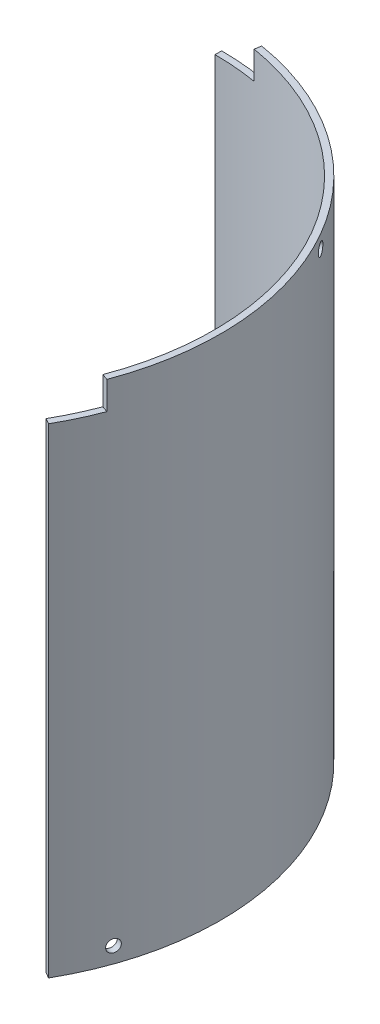
from build123d import *
from build123d.topology import SkipClean

# Parameters (mm, degrees)
BOSS_EXTRUDE1_DEPTH = 93
SKETCH8_R           = 1.125
CUT_EXTRUDE1_DEPTH  = 124.766046621
CIRPATTERN1_COUNT   = 2
CIRPATTERN1_ANGLE   = 99
SKETCH9_R           = 1.125
CUT_EXTRUDE2_DEPTH  = 4
CUT_EXTRUDE3_START  = -5.2
CUT_EXTRUDE3_DEPTH  = 5.2
CUT_EXTRUDE4_START  = -0.1
CUT_EXTRUDE4_DEPTH  = 0.1
CUT_EXTRUDE5_DEPTH  = 0.1
CUT_EXTRUDE7_DEPTH  = 117.6697906


with BuildPart() as part:
    # Sketch1 → Boss-Extrude1 (new body)
    with BuildSketch(Plane(origin=(0, 0, 0), x_dir=(1, 0, 0), z_dir=(0, 1, 0))):
        with BuildLine():
            Line((43.301270189, 25), (42.262039705, 24.4))
            ThreePointArc((42.262039705, 24.4), (47.137180323, 12.630369401), (48.8, 0))
            ThreePointArc((48.8, 0), (47.137180323, -12.630369401), (42.262039705, -24.4))
            Line((42.262039705, -24.4), (43.301270189, -25))
            ThreePointArc((43.301270189, -25), (48.296291314, -12.940952255), (50, 0))
            ThreePointArc((50, 0), (48.296291314, 12.940952255), (43.301270189, 25))
        make_face()
        with BuildLine():
            ThreePointArc((0, 48.8), (24.4, 42.262039705), (42.262039705, 24.4))
            Line((42.262039705, 24.4), (43.301270189, 25))
            ThreePointArc((43.301270189, 25), (25, 43.301270189), (0, 50))
            Line((0, 50), (0, 48.8))
        make_face()
    extrude(amount=BOSS_EXTRUDE1_DEPTH)

    # Sketch8 → Cut-Extrude1 (cut, through all)
    with BuildSketch(Plane(origin=(47.132074555, 0, 16.690342962), x_dir=(0.33380685923377484, 0, -0.9426414910921771), z_dir=(0.9426414910921771, 0, 0.33380685923377484))):
        with Locations((0, 3)):
            Circle(SKETCH8_R)
    cut_extrude1 = extrude(amount=-CUT_EXTRUDE1_DEPTH, mode=Mode.SUBTRACT)

    # CirPattern1: Cut-Extrude1 ×2 about axis
    cirpattern1_axis = Axis((0, 93, 0), (0, 1, 0))
    for i in range(1, CIRPATTERN1_COUNT):
        add(cut_extrude1.rotate(cirpattern1_axis, i * CIRPATTERN1_ANGLE / (CIRPATTERN1_COUNT - 1)), mode=Mode.SUBTRACT)

    # Sketch9 → Cut-Extrude2 (cut)
    with SkipClean():  # the faces are left unmerged after this step: merging them gives an invalid solid
        with BuildSketch(Plane(origin=(43.301270189, 0, -25), x_dir=(-0.4999999999999981, 0, -0.8660254037844397), z_dir=(0.8660254037844398, 0, -0.4999999999999982))):
            with Locations((0, 90.5)):
                Circle(SKETCH9_R)
        extrude(amount=-CUT_EXTRUDE2_DEPTH, mode=Mode.SUBTRACT)

    # Sketch10 → Cut-Extrude3 (cut)
    with SkipClean():  # the faces are left unmerged after this step: merging them gives an invalid solid
        with BuildSketch(Plane(origin=(0, 93, 0), x_dir=(1, 0, 0), z_dir=(0, 1, 0)).offset(CUT_EXTRUDE3_START)):
            with BuildLine():
                ThreePointArc((45.681823724, -17.164235528), (44.120515076, -20.852341582), (42.262039705, -24.4))
                Line((42.262039705, -24.4), (43.301270189, -25))
                ThreePointArc((43.301270189, -25), (45.205445775, -21.365104079), (46.805147258, -17.586306893))
                Line((46.805147258, -17.586306893), (45.681823724, -17.164235528))
            make_face()
            with BuildLine():
                Line((0, 50), (0, 48.8))
                ThreePointArc((0, 48.8), (4.015214241, 48.634535616), (8.0032, 48.139264533))
                Line((8.0032, 48.139264533), (8.2, 49.323016939))
                ThreePointArc((8.2, 49.323016939), (4.113949017, 49.83046682), (0, 50))
            make_face()
        extrude(amount=CUT_EXTRUDE3_DEPTH, mode=Mode.SUBTRACT)

    # Sketch11 → Cut-Extrude4 (cut)
    with SkipClean():  # the faces are left unmerged after this step: merging them gives an invalid solid
        with BuildSketch(Plane(origin=(0, 93, 0), x_dir=(1, 0, 0), z_dir=(0, 1, 0)).offset(CUT_EXTRUDE4_START)):
            with BuildLine():
                Line((8.2, 49.323016939), (8.0032, 48.139264533))
                ThreePointArc((8.0032, 48.139264533), (42.26886825, 24.388168789), (45.681823724, -17.164235528))
                Line((45.681823724, -17.164235528), (46.805147258, -17.586306893))
                ThreePointArc((46.805147258, -17.586306893), (43.308266649, 24.987877858), (8.2, 49.323016939))
            make_face()
        extrude(amount=CUT_EXTRUDE4_DEPTH, mode=Mode.SUBTRACT)

    # Sketch1<3> → Cut-Extrude5 (cut)
    with SkipClean():  # the faces are left unmerged after this step: merging them gives an invalid solid
        with BuildSketch(Plane(origin=(0, 0, 0), x_dir=(1, 0, 0), z_dir=(0, 1, 0))):
            with BuildLine():
                Line((43.301270189, 25), (42.262039705, 24.4))
                ThreePointArc((42.262039705, 24.4), (47.137180323, 12.630369401), (48.8, 0))
                ThreePointArc((48.8, 0), (47.137180323, -12.630369401), (42.262039705, -24.4))
                Line((42.262039705, -24.4), (43.301270189, -25))
                ThreePointArc((43.301270189, -25), (48.296291314, -12.940952255), (50, 0))
                ThreePointArc((50, 0), (48.296291314, 12.940952255), (43.301270189, 25))
            make_face()
            with BuildLine():
                ThreePointArc((0, 48.8), (24.4, 42.262039705), (42.262039705, 24.4))
                Line((42.262039705, 24.4), (43.301270189, 25))
                ThreePointArc((43.301270189, 25), (25, 43.301270189), (0, 50))
                Line((0, 50), (0, 48.8))
            make_face()
        extrude(amount=CUT_EXTRUDE5_DEPTH, mode=Mode.SUBTRACT)

    # Sketch13 → Cut-Extrude7 (cut, through all)
    with SkipClean():  # the faces are left unmerged after this step: merging them gives an invalid solid
        with BuildSketch(Plane.XZ.offset(-0.1)):
            with BuildLine():
                Line((0.2, -49.999599998), (0.2, -48.799590162))
                ThreePointArc((0.2, -48.799590162), (0.10000021, -48.79989754), (0, -48.8))
                Line((0, -48.8), (0, -50))
                ThreePointArc((0, -50), (0.1000002, -49.9999), (0.2, -49.999599998))
            make_face()
            with BuildLine():
                Line((43.301270189, 25), (42.262039705, 24.4))
                ThreePointArc((42.262039705, 24.4), (42.311951077, 24.313346048), (42.361684775, 24.22659))
                Line((42.361684775, 24.22659), (43.400923778, 24.826594918))
                ThreePointArc((43.400923778, 24.826594918), (43.351183686, 24.913347286), (43.301270189, 25))
            make_face()
        extrude(amount=-CUT_EXTRUDE7_DEPTH, mode=Mode.SUBTRACT)


solid = part.part
